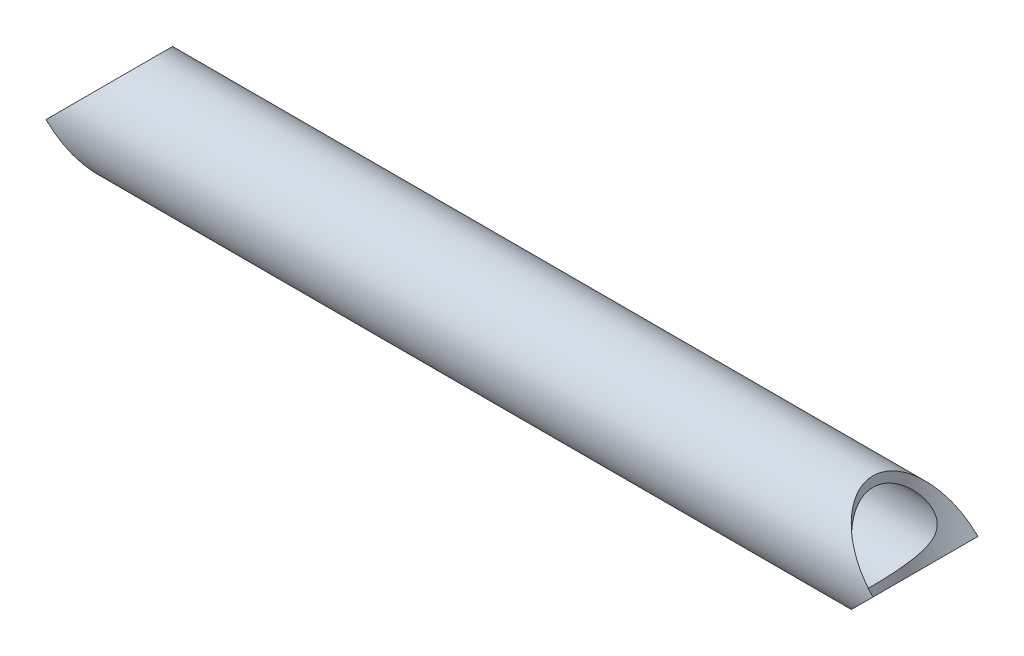
from build123d import *

# Parameters (mm, degrees)
BOSS_EXTRUDE1_DEPTH      = 100
BOSS_EXTRUDE1_DEPTH_BACK = 100
SKETCH1_R                = 12.699999999999998
SKETCH1_R_2              = 10.286999999999999
CUT_EXTRUDE1_DEPTH       = 50
CUT_EXTRUDE1_DEPTH_BACK  = 50
SKETCH2_R                = 12.69999999999999


with BuildPart() as part:
    # Sketch1 → Boss-Extrude1 (new, two sides: drawn at the far end of the back side and taken through both)
    with BuildSketch(Plane(origin=(0, 0, 0), x_dir=(0, 0, -1), z_dir=(1, 0, 0)).offset(-BOSS_EXTRUDE1_DEPTH_BACK)):
        Circle(SKETCH1_R)
        Circle(SKETCH1_R_2, mode=Mode.SUBTRACT)
    extrude(amount=BOSS_EXTRUDE1_DEPTH + BOSS_EXTRUDE1_DEPTH_BACK)

    # Sketch2 → Cut-Extrude1 (cut, two sides: drawn at the far end of the back side and taken through both)
    with BuildSketch(Plane(origin=(0, 0, 0), x_dir=(1, 0, 0), z_dir=(0, 1, 0)).offset(-CUT_EXTRUDE1_DEPTH_BACK)):
        with Locations((-100, 0)):
            Circle(SKETCH2_R)
        with Locations((100, 0)):
            Circle(SKETCH2_R)
    extrude(amount=CUT_EXTRUDE1_DEPTH + CUT_EXTRUDE1_DEPTH_BACK, mode=Mode.SUBTRACT)


solid = part.part
